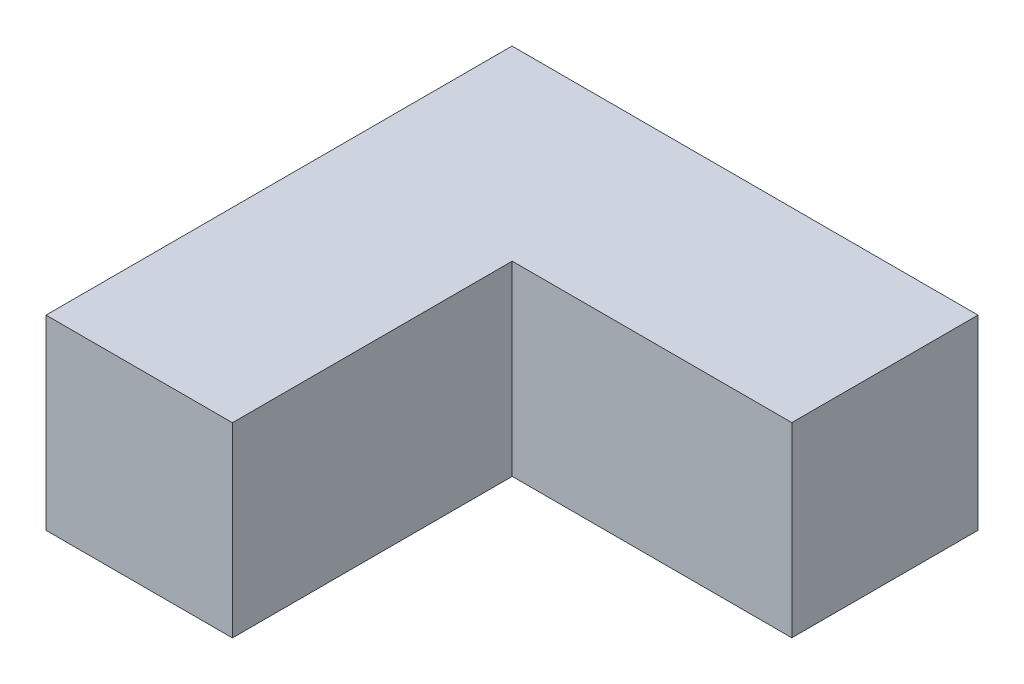
from build123d import *

# Parameters (mm, degrees)
ESQUISSE1_W        = 5
ESQUISSE1_H        = 2
BOSS_EXTRU_1_DEPTH = 2
ESQUISSE2_W        = 1.997705708
ESQUISSE2_H        = 2
BOSS_EXTRU_2_DEPTH = 3


with BuildPart() as part:
    # Esquisse1 → Boss.-Extru.1 (new body)
    with BuildSketch(Plane(origin=(0, 0, 0), x_dir=(0, 0, -1), z_dir=(1, 0, 0))):
        with Locations((0.044776119, -0.679104478)):
            Rectangle(ESQUISSE1_W, ESQUISSE1_H)
    extrude(amount=BOSS_EXTRU_1_DEPTH)

    # Esquisse2 → Boss.-Extru.2 (add)
    with BuildSketch(Plane(origin=(2, 0, 0), x_dir=(0, 0, -1), z_dir=(1, 0, 0))):
        with Locations((1.545923265, -0.679104478)):
            Rectangle(ESQUISSE2_W, ESQUISSE2_H)
    extrude(amount=BOSS_EXTRU_2_DEPTH)


solid = part.part
